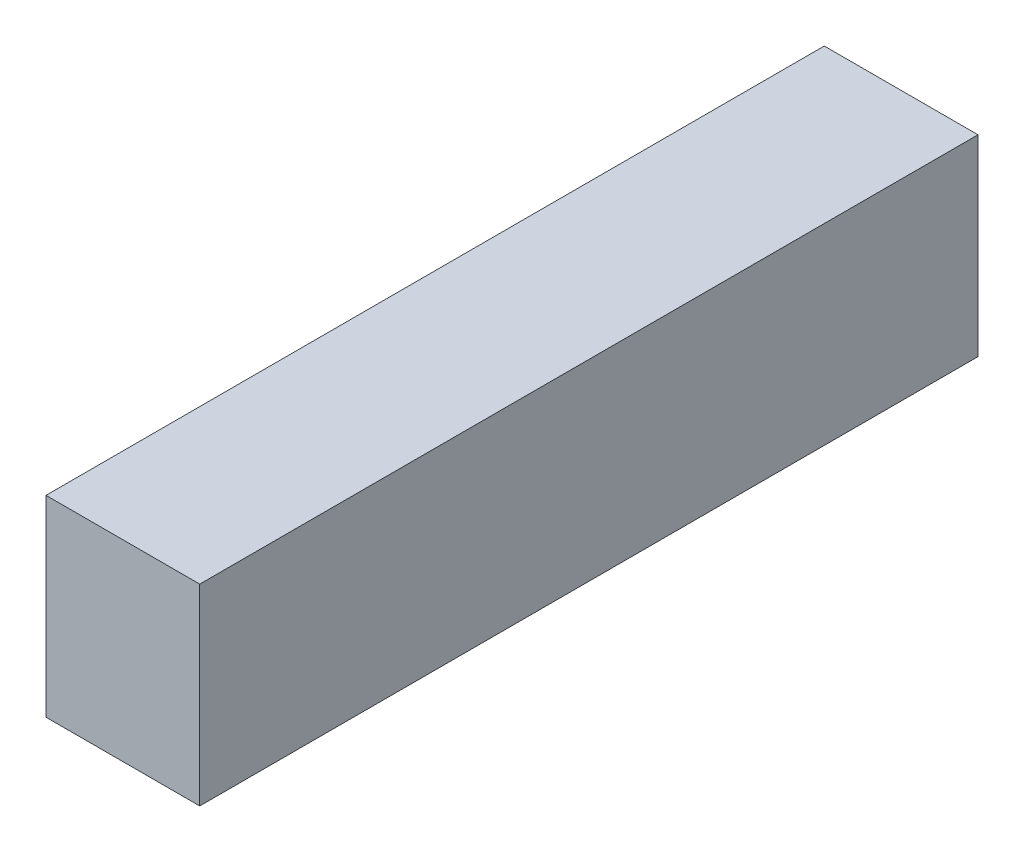
from build123d import *

# Parameters (mm, degrees)
SKETCH1_W           = 320
SKETCH1_H           = 400
BOSS_EXTRUDE1_DEPTH = 1620


with BuildPart() as part:
    # Sketch1 → Boss-Extrude1 (new body)
    with BuildSketch(Plane.XY):
        with Locations((-31.340206186, -4.536082474)):
            Rectangle(SKETCH1_W, SKETCH1_H)
    extrude(amount=BOSS_EXTRUDE1_DEPTH)


solid = part.part
